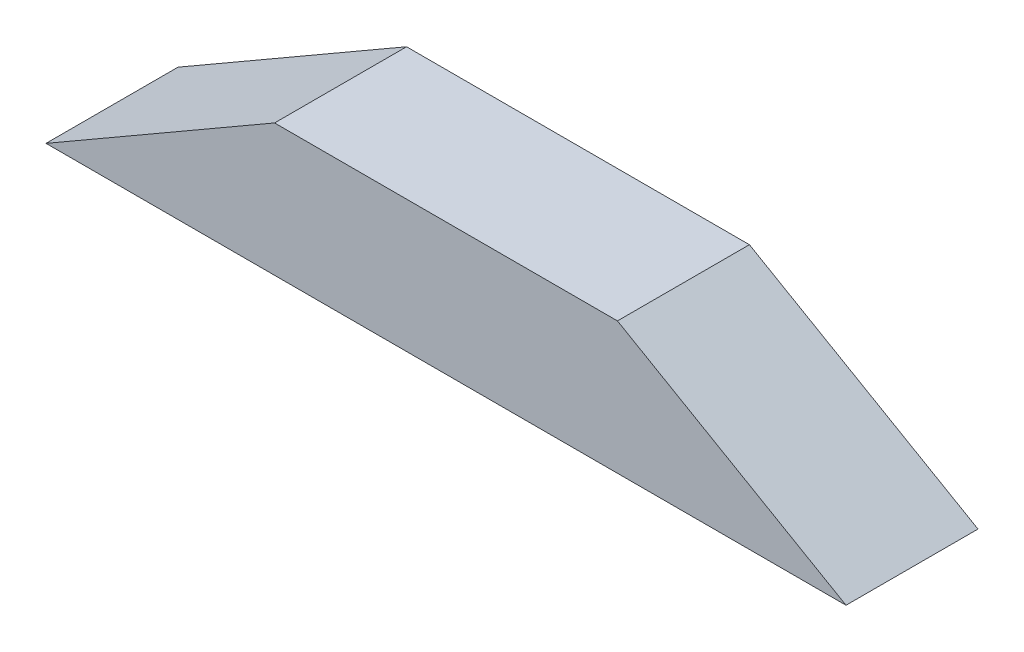
from build123d import *

# Parameters (mm, degrees)
BOSS_EXTRUDE1_DEPTH = 10


with BuildPart() as part:
    # Sketch1 → Boss-Extrude1 (new body)
    with BuildSketch(Plane.XY):
        Polygon((268.5420204, -123.079363354), (251.221512325, -113.079363354), (225.240750211, -113.079363354), (207.920242135, -123.079363354), align=None)
    extrude(amount=BOSS_EXTRUDE1_DEPTH)


solid = part.part
